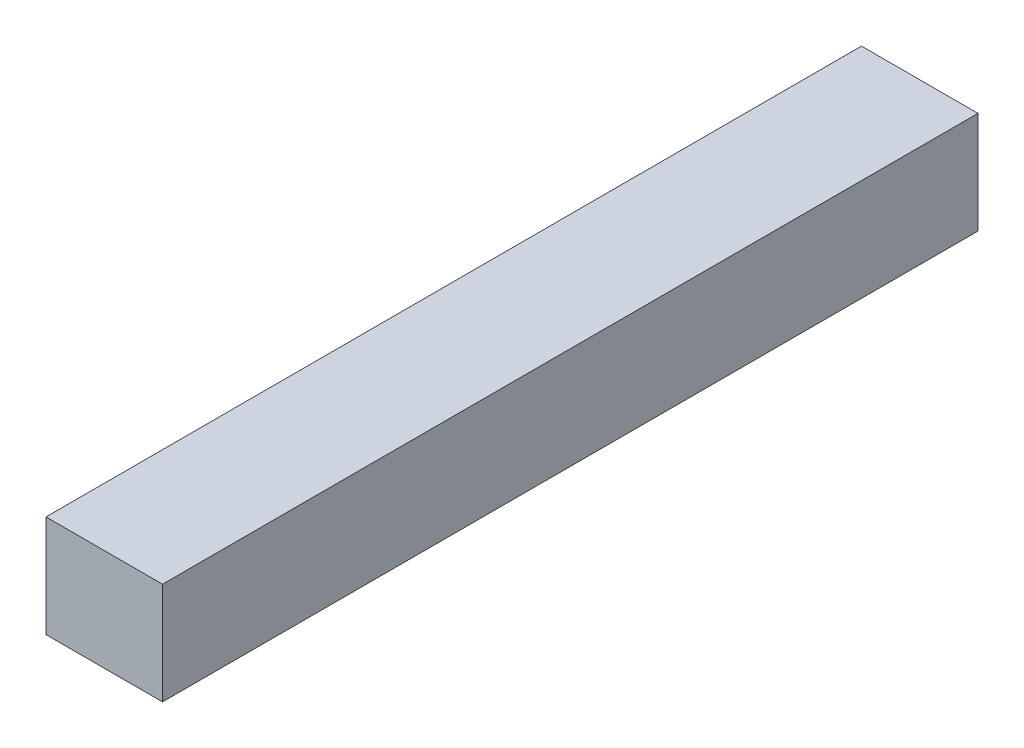
from build123d import *

# Parameters (mm, degrees)
SKETCH1_W           = 8
SKETCH1_H           = 7
BOSS_EXTRUDE1_DEPTH = 28


with BuildPart() as part:
    # Sketch1 → Boss-Extrude1 (new, symmetric)
    with BuildSketch(Plane.XY):
        Rectangle(SKETCH1_W, SKETCH1_H)
    extrude(amount=BOSS_EXTRUDE1_DEPTH, both=True)


solid = part.part
